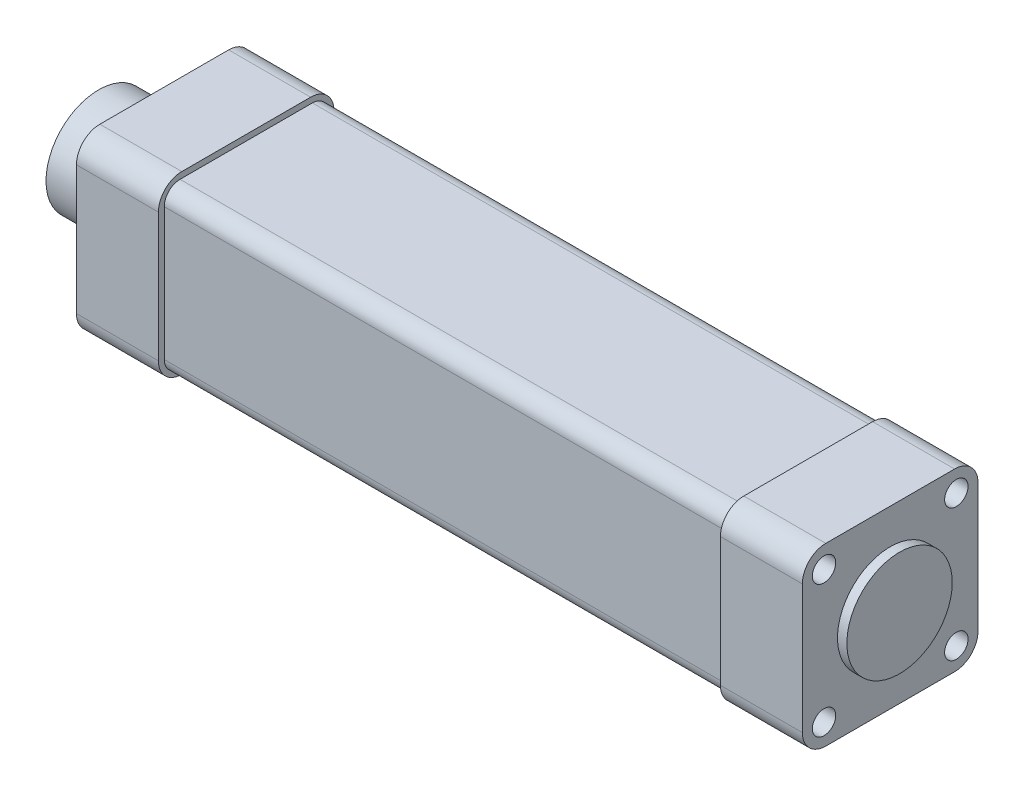
from build123d import *

# Parameters (mm, degrees)
ESQUISSE1_R             = 5
ESQUISSE1_R_2           = 31.5
BOSS_EXTRU_1_DEPTH      = 240
ESQUISSE3_R             = 5
BOSS_EXTRU_3_DEPTH      = 35
ESQUISSE4_R             = 22.5
BOSS_EXTRU_4_DEPTH      = 4
BOSS_EXTRU_5_START      = 35
ESQUISSE5_R             = 5
BOSS_EXTRU_5_DEPTH      = 35
BOSS_EXTRU_6_START      = 4
ESQUISSE6_R             = 22.5
BOSS_EXTRU_6_DEPTH      = 4
BOSS_EXTRU_7_START      = 24
ESQUISSE7_R             = 22.5
BOSS_EXTRU_7_DEPTH      = 24
ENL_V_MAT_EXTRU_1_REACH = 348.087
ESQUISSE8_R             = 10


with BuildPart() as part:
    # Esquisse1 → Boss.-Extru.1 (new body)
    with BuildSketch(Plane(origin=(0, 0, 0), x_dir=(0, 0, -1), z_dir=(1, 0, 0))):
        with BuildLine():
            Line((35, 28.25), (35, -28.25))
            ThreePointArc((35, -28.25), (33.022970773, -33.022970773), (28.25, -35))
            Line((28.25, -35), (-28.25, -35))
            ThreePointArc((-28.25, -35), (-33.022970773, -33.022970773), (-35, -28.25))
            Line((-35, -28.25), (-35, 28.25))
            ThreePointArc((-35, 28.25), (-33.022970773, 33.022970773), (-28.25, 35))
            Line((-28.25, 35), (28.25, 35))
            ThreePointArc((28.25, 35), (33.022970773, 33.022970773), (35, 28.25))
        make_face()
        with Locations((28.25, -28.25)):
            Circle(ESQUISSE1_R, mode=Mode.SUBTRACT)
        with Locations((28.25, 28.25)):
            Circle(ESQUISSE1_R, mode=Mode.SUBTRACT)
        with Locations(Location((-28.25, -28.25, 0), (0, 0, 180))):
            Circle(ESQUISSE1_R, mode=Mode.SUBTRACT)
        with Locations(Location((-28.25, 28.25, 0), (0, 0, 180))):
            Circle(ESQUISSE1_R, mode=Mode.SUBTRACT)
        Circle(ESQUISSE1_R_2, mode=Mode.SUBTRACT)
    extrude(amount=BOSS_EXTRU_1_DEPTH)

    # Esquisse3 → Boss.-Extru.3 (add)
    with BuildSketch(Plane(origin=(240, 0, 0), x_dir=(0, 0, -1), z_dir=(1, 0, 0))):
        with BuildLine():
            Line((-27.5, -37.5), (27.5, -37.5))
            ThreePointArc((27.5, -37.5), (34.571067812, -34.571067812), (37.5, -27.5))
            Line((37.5, -27.5), (37.5, 27.5))
            ThreePointArc((37.5, 27.5), (34.571067812, 34.571067812), (27.5, 37.5))
            Line((27.5, 37.5), (-27.5, 37.5))
            ThreePointArc((-27.5, 37.5), (-34.571067812, 34.571067812), (-37.5, 27.5))
            Line((-37.5, 27.5), (-37.5, -27.5))
            ThreePointArc((-37.5, -27.5), (-34.571067812, -34.571067812), (-27.5, -37.5))
        make_face()
        with Locations(Location((-28.25, 28.25, 0), (0, 0, 180))):
            Circle(ESQUISSE3_R, mode=Mode.SUBTRACT)
        with Locations((28.25, 28.25)):
            Circle(ESQUISSE3_R, mode=Mode.SUBTRACT)
        with Locations((28.25, -28.25)):
            Circle(ESQUISSE3_R, mode=Mode.SUBTRACT)
        with Locations(Location((-28.25, -28.25, 0), (0, 0, 180))):
            Circle(ESQUISSE3_R, mode=Mode.SUBTRACT)
    extrude(amount=BOSS_EXTRU_3_DEPTH)

    # Esquisse4 → Boss.-Extru.4 (add)
    with BuildSketch(Plane(origin=(275, 0, 0), x_dir=(0, 0, -1), z_dir=(1, 0, 0))):
        Circle(ESQUISSE4_R)
    extrude(amount=BOSS_EXTRU_4_DEPTH)

    # Esquisse5 → Boss.-Extru.5 (add)
    with BuildSketch(Plane.ZY.offset(BOSS_EXTRU_5_START)):
        with BuildLine():
            Line((27.5, -37.5), (-27.5, -37.5))
            ThreePointArc((-27.5, -37.5), (-34.571067812, -34.571067812), (-37.5, -27.5))
            Line((-37.5, -27.5), (-37.5, 27.5))
            ThreePointArc((-37.5, 27.5), (-34.571067812, 34.571067812), (-27.5, 37.5))
            Line((-27.5, 37.5), (27.5, 37.5))
            ThreePointArc((27.5, 37.5), (34.571067812, 34.571067812), (37.5, 27.5))
            Line((37.5, 27.5), (37.5, -27.5))
            ThreePointArc((37.5, -27.5), (34.571067812, -34.571067812), (27.5, -37.5))
        make_face()
        with Locations((-28.25, 28.25)):
            Circle(ESQUISSE5_R, mode=Mode.SUBTRACT)
        with Locations((28.25, 28.25)):
            Circle(ESQUISSE5_R, mode=Mode.SUBTRACT)
        with Locations((28.25, -28.25)):
            Circle(ESQUISSE5_R, mode=Mode.SUBTRACT)
        with Locations((-28.25, -28.25)):
            Circle(ESQUISSE5_R, mode=Mode.SUBTRACT)
    extrude(amount=-BOSS_EXTRU_5_DEPTH)

    # Esquisse6 → Boss.-Extru.6 (add)
    with BuildSketch(Plane.ZY.offset(35).offset(BOSS_EXTRU_6_START)):
        with Locations(Location((0, 0, 0), (0, 0, 180))):
            Circle(ESQUISSE6_R)
    extrude(amount=-BOSS_EXTRU_6_DEPTH)

    # Esquisse7 → Boss.-Extru.7 (add)
    with BuildSketch(Plane.ZY.offset(39).offset(BOSS_EXTRU_7_START)):
        with Locations(Location((0, 0, 0), (0, 0, 180))):
            Circle(ESQUISSE7_R)
    extrude(amount=-BOSS_EXTRU_7_DEPTH)

    # Esquisse8 → Enlèv. mat.-Extru.1 (cut, up to next)
    with BuildSketch(Plane.ZY.offset(63), mode=Mode.PRIVATE) as enl_v_mat_extru_1_sk1:
        Circle(ESQUISSE8_R)
    enl_v_mat_extru_1_tool1 = extrude(enl_v_mat_extru_1_sk1.sketch, amount=-ENL_V_MAT_EXTRU_1_REACH, mode=Mode.PRIVATE) & part.part
    add(enl_v_mat_extru_1_tool1.solids().sort_by_distance((-63, 0, 0))[0], mode=Mode.SUBTRACT)


solid = part.part
